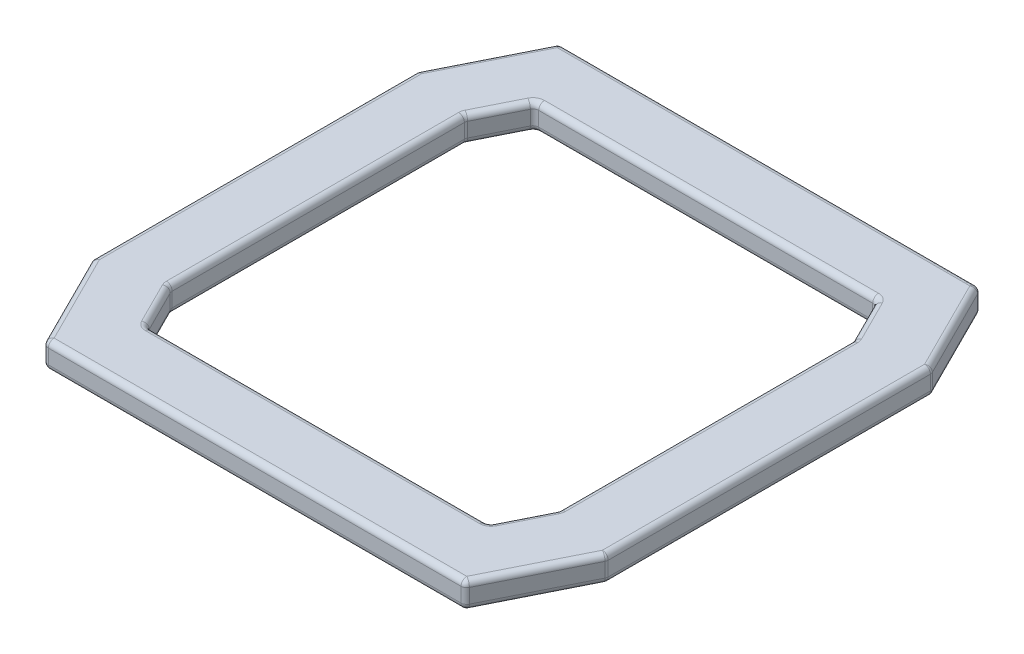
from build123d import *

# Parameters (mm, degrees)
BOSS_EXTRUDE1_DEPTH = 2.25
FILLET1_R           = 1


with BuildPart() as part:
    # Sketch1 → Boss-Extrude1 (new, symmetric)
    with BuildSketch(Plane(origin=(0, 0, 0), x_dir=(1, 0, 0), z_dir=(0, 1, 0))):
        Polygon((-36.298373876, -44.5), (36.298373876, -44.5), (44.5, -28.096747752), (44.5, 28.096747752), (36.298373876, 44.5), (-36.298373876, 44.5), (-44.5, 28.096747752), (-44.5, -28.096747752), align=None)
        Polygon((-29.5, -33.5), (29.5, -33.5), (33.5, -25.5), (33.5, 25.5), (29.5, 33.5), (-29.5, 33.5), (-33.5, 25.5), (-33.5, -25.5), align=None, mode=Mode.SUBTRACT)
    extrude(amount=BOSS_EXTRUDE1_DEPTH, both=True)

    # Fillet1
    fillet1_edges = [part.edges().sort_by_distance(p)[0] for p in [
        (44.5, -2.25, 0),
        (40.399186938, -2.25, 36.298373876),
        (0, -2.25, 44.5),
        (-40.399186938, -2.25, 36.298373876),
        (40.399186938, 2.25, 36.298373876),
        (-44.5, 0, 28.096747752),
        (-44.5, 0, -28.096747752),
        (-36.298373876, 0, -44.5),
        (36.298373876, 0, -44.5),
        (44.5, 0, -28.096747752),
        (44.5, 0, 28.096747752),
        (36.298373876, 0, 44.5),
        (-36.298373876, 0, 44.5),
        (44.5, 2.25, 0),
        (40.399186938, 2.25, -36.298373876),
        (0, 2.25, -44.5),
        (31.5, -2.25, -29.5),
        (33.5, 0, -25.5),
        (0, -2.25, -33.5),
        (29.5, 0, -33.5),
        (-31.5, -2.25, -29.5),
        (-29.5, 0, -33.5),
        (-33.5, -2.25, 0),
        (-40.399186938, 2.25, -36.298373876),
        (-33.5, 0, -25.5),
        (-31.5, -2.25, 29.5),
        (-33.5, 0, 25.5),
        (0, -2.25, 33.5),
        (-29.5, 0, 33.5),
        (31.5, -2.25, 29.5),
        (29.5, 0, 33.5),
        (33.5, -2.25, 0),
        (33.5, 0, 25.5),
        (31.5, 2.25, -29.5),
        (0, 2.25, -33.5),
        (-31.5, 2.25, -29.5),
        (-33.5, 2.25, 0),
        (-31.5, 2.25, 29.5),
        (0, 2.25, 33.5),
        (31.5, 2.25, 29.5),
        (-44.5, 2.25, 0),
        (33.5, 2.25, 0),
        (-40.399186938, 2.25, 36.298373876),
        (-44.5, -2.25, 0),
        (0, 2.25, 44.5),
        (-40.399186938, -2.25, -36.298373876),
        (0, -2.25, -44.5),
        (40.399186938, -2.25, -36.298373876),
    ]]
    fillet(fillet1_edges, radius=FILLET1_R)


solid = part.part
